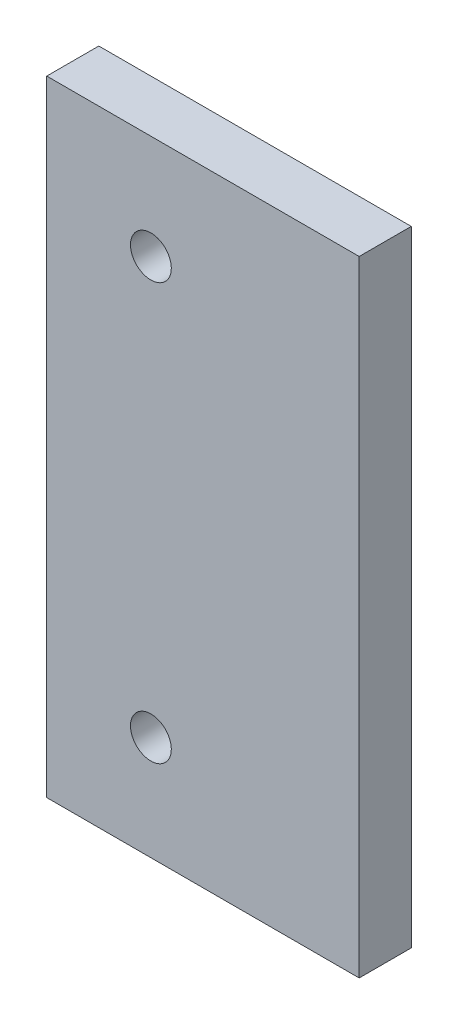
from build123d import *

# Parameters (mm, degrees)
SKETCH2_W           = 38.1
SKETCH2_H           = 76.2
SKETCH2_R           = 2.4892
BOSS_EXTRUDE1_DEPTH = 3.175


with BuildPart() as part:
    # Sketch2 → Boss-Extrude1 (new, symmetric)
    with BuildSketch(Plane.XY):
        Rectangle(SKETCH2_W, SKETCH2_H)
        with Locations((-6.35, 25.4)):
            Circle(SKETCH2_R, mode=Mode.SUBTRACT)
        with Locations((-6.35, -25.4)):
            Circle(SKETCH2_R, mode=Mode.SUBTRACT)
    extrude(amount=BOSS_EXTRUDE1_DEPTH, both=True)


solid = part.part
